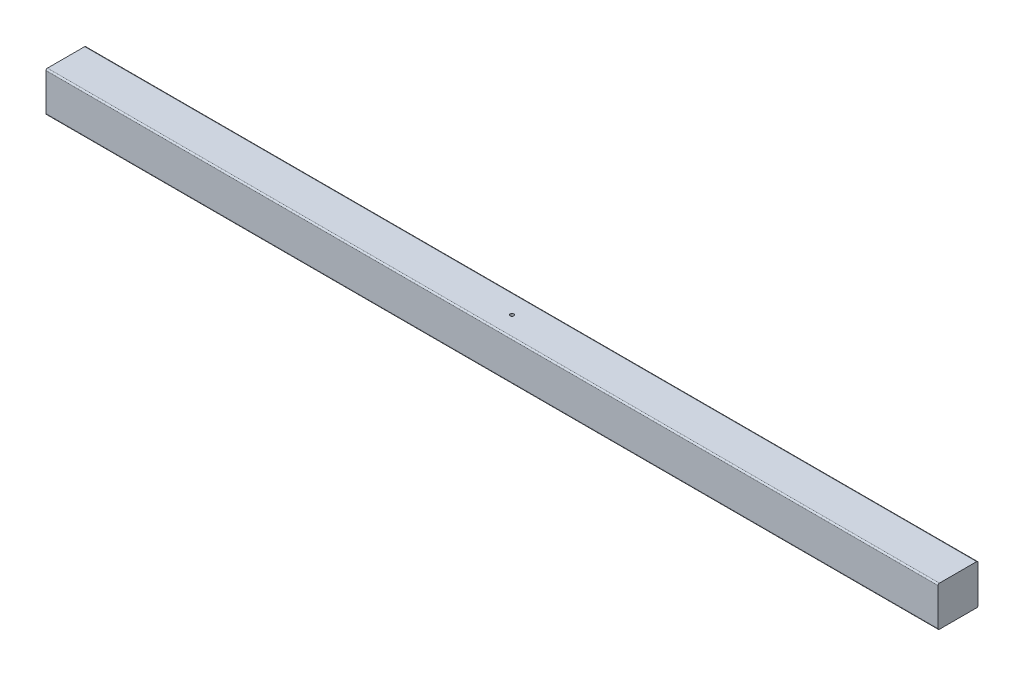
from build123d import *

# Parameters (mm, degrees)
SKETCH1_W                      = 88.9
SKETCH1_H                      = 88.9
BOSS_EXTRUDE1_DEPTH            = 1981.2
FILLET1_R                      = 3.175
F_5_16_0_3125_DIAMETER_HOLE1_D = 7.9375


with BuildPart() as part:
    # Sketch1 → Boss-Extrude1 (new body)
    with BuildSketch(Plane(origin=(0, 0, 0), x_dir=(0, 0, -1), z_dir=(1, 0, 0))):
        Rectangle(SKETCH1_W, SKETCH1_H)
    extrude(amount=BOSS_EXTRUDE1_DEPTH)

    # Fillet1
    fillet1_edges = [part.edges().sort_by_distance(p)[0] for p in [
        (990.6, -44.45, -44.45),
        (990.6, -44.45, 44.45),
        (990.6, 44.45, 44.45),
        (990.6, 44.45, -44.45),
    ]]
    fillet(fillet1_edges, radius=FILLET1_R)

    # 5/16 (0.3125) Diameter Hole1 (through all)
    with Locations(Plane(origin=(0, 44.45, 0), x_dir=(1, 0, 0), z_dir=(0, 1, 0))):
        with Locations((990.6, 0)):
            Hole(F_5_16_0_3125_DIAMETER_HOLE1_D / 2)


solid = part.part
